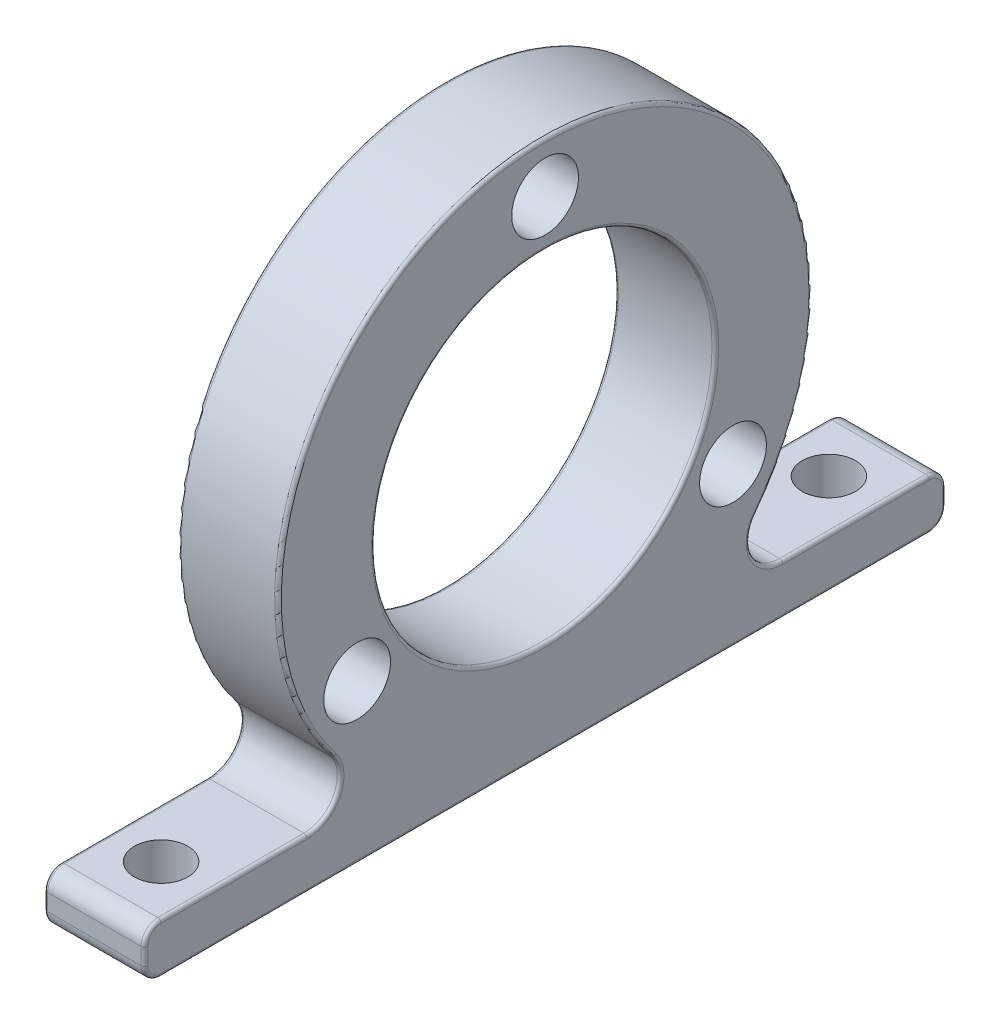
from build123d import *

# Parameters (mm, degrees)
SKETCH_1_R          = 5.1
EXTRUDE_1_DEPTH     = 3
CUT_EXTRUDE_2_REACH = 21.059
SKETCH_5_R          = 0.8
FILLET_1_R          = 0.1
CUT_EXTRUDE_3_REACH = 16.731
SKETCH_6_R          = 1


with BuildPart() as part:
    # 草图1 → 凸台-拉伸1 (new body)
    with BuildSketch(Plane(origin=(0, 0, 0), x_dir=(0, 0, -1), z_dir=(1, 0, 0))):
        with BuildLine():
            Line((-11.5, -6.5), (-7.123903424, -6.5))
            ThreePointArc((-7.123903424, -6.5), (-6.226375957, -5.940958552), (-6.332358599, -4.888888889))
            ThreePointArc((-6.332358599, -4.888888889), (0, 8), (6.332358599, -4.888888889))
            ThreePointArc((6.332358599, -4.888888889), (6.226375957, -5.940958552), (7.123903424, -6.5))
            Line((7.123903424, -6.5), (11.5, -6.5))
            ThreePointArc((11.5, -6.5), (11.853553391, -6.646446609), (12, -7))
            Line((12, -7), (12, -7.5))
            ThreePointArc((12, -7.5), (11.853553391, -7.853553391), (11.5, -8))
            Line((11.5, -8), (-11.5, -8))
            ThreePointArc((-11.5, -8), (-11.853553391, -7.853553391), (-12, -7.5))
            Line((-12, -7.5), (-12, -7))
            ThreePointArc((-12, -7), (-11.853553391, -6.646446609), (-11.5, -6.5))
        make_face()
        Circle(SKETCH_1_R, mode=Mode.SUBTRACT)
    extrude(amount=EXTRUDE_1_DEPTH)

    # 草图5 → 切除-拉伸2 (cut, up to next)
    with BuildSketch(Plane(origin=(0, -6.5, 0), x_dir=(1, 0, 0), z_dir=(0, 1, 0)), mode=Mode.PRIVATE) as cut_extrude_2_sk1:
        with Locations(Location((1.5, -10, 0), (0, 0, 270))):
            Circle(SKETCH_5_R)
    cut_extrude_2_tool1 = extrude(cut_extrude_2_sk1.sketch, amount=-CUT_EXTRUDE_2_REACH, mode=Mode.PRIVATE) & part.part
    # 草图5 → 切除-拉伸2 (cut, up to next)
    with BuildSketch(Plane(origin=(0, -6.5, 0), x_dir=(1, 0, 0), z_dir=(0, 1, 0)), mode=Mode.PRIVATE) as cut_extrude_2_sk2:
        with Locations(Location((1.5, 10, 0), (0, 0, 270))):
            Circle(SKETCH_5_R)
    cut_extrude_2_tool2 = extrude(cut_extrude_2_sk2.sketch, amount=-CUT_EXTRUDE_2_REACH, mode=Mode.PRIVATE) & part.part
    add(cut_extrude_2_tool1.solids().sort_by_distance((1.5, -6.5, 10))[0], mode=Mode.SUBTRACT)
    add(cut_extrude_2_tool2.solids().sort_by_distance((1.5, -6.5, -10))[0], mode=Mode.SUBTRACT)

    # 圆角1
    fillet_1_edges = [part.edges().sort_by_distance(p)[0] for p in [
        (3, -5.940958552, 6.226375957),
        (0, -6.5, -9.311951712),
        (0, -6.646446609, -11.853553391),
        (0, -7.25, -12),
        (0, -7.853553391, -11.853553391),
        (0, -8, 0),
        (0, -7.853553391, 11.853553391),
        (3, -6.5, 9.311951712),
        (0, -7.25, 12),
        (0, -6.646446609, 11.853553391),
        (0, -6.5, 9.311951712),
        (0, -5.940958552, 6.226375957),
        (0, 8, 0),
        (0, -5.940958552, -6.226375957),
        (3, -6.646446609, 11.853553391),
        (3, -7.25, 12),
        (3, -7.853553391, 11.853553391),
        (3, -8, 0),
        (3, -7.853553391, -11.853553391),
        (0, 0, 5.1),
        (3, 0, 5.1),
        (3, -7.25, -12),
        (3, -6.646446609, -11.853553391),
        (3, -6.5, -9.311951712),
        (3, -5.940958552, -6.226375957),
        (3, 8, 0),
    ]]
    fillet(fillet_1_edges, radius=FILLET_1_R)

    # 草图6 → 切除-拉伸3 (cut, up to next)
    with BuildSketch(Plane(origin=(3, 0, 0), x_dir=(0, 0, -1), z_dir=(1, 0, 0)), mode=Mode.PRIVATE) as cut_extrude_3_sk1:
        with Locations((0, 6.5)):
            Circle(SKETCH_6_R)
    cut_extrude_3_tool1 = extrude(cut_extrude_3_sk1.sketch, amount=-CUT_EXTRUDE_3_REACH, mode=Mode.PRIVATE) & part.part
    # 草图6 → 切除-拉伸3 (cut, up to next)
    with BuildSketch(Plane(origin=(3, 0, 0), x_dir=(0, 0, -1), z_dir=(1, 0, 0)), mode=Mode.PRIVATE) as cut_extrude_3_sk2:
        with Locations((5.629165125, -3.25)):
            Circle(SKETCH_6_R)
    cut_extrude_3_tool2 = extrude(cut_extrude_3_sk2.sketch, amount=-CUT_EXTRUDE_3_REACH, mode=Mode.PRIVATE) & part.part
    # 草图6 → 切除-拉伸3 (cut, up to next)
    with BuildSketch(Plane(origin=(3, 0, 0), x_dir=(0, 0, -1), z_dir=(1, 0, 0)), mode=Mode.PRIVATE) as cut_extrude_3_sk3:
        with Locations((-5.629165125, -3.25)):
            Circle(SKETCH_6_R)
    cut_extrude_3_tool3 = extrude(cut_extrude_3_sk3.sketch, amount=-CUT_EXTRUDE_3_REACH, mode=Mode.PRIVATE) & part.part
    add(cut_extrude_3_tool1.solids().sort_by_distance((3, 6.5, 0))[0], mode=Mode.SUBTRACT)
    add(cut_extrude_3_tool2.solids().sort_by_distance((3, -3.25, -5.629165))[0], mode=Mode.SUBTRACT)
    add(cut_extrude_3_tool3.solids().sort_by_distance((3, -3.25, 5.629165))[0], mode=Mode.SUBTRACT)


solid = part.part
